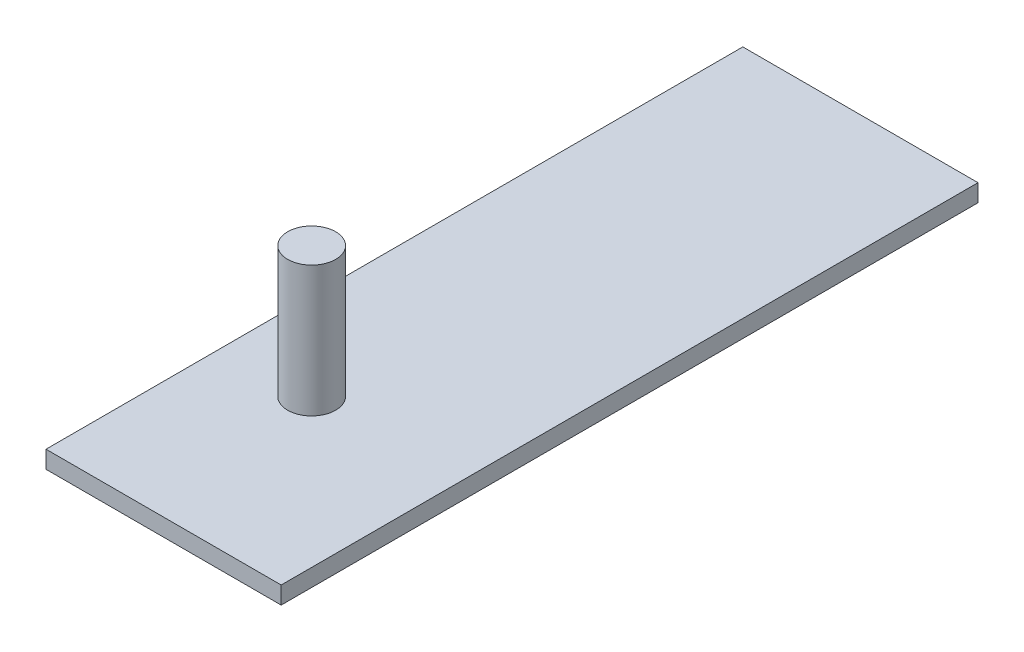
from build123d import *

# Parameters (mm, degrees)
SKETCH1_W           = 27
SKETCH1_H           = 80
BOSS_EXTRUDE1_DEPTH = 2
SKETCH2_R           = 2.753572969
BOSS_EXTRUDE2_DEPTH = 15


with BuildPart() as part:
    # Sketch1 → Boss-Extrude1 (new body)
    with BuildSketch(Plane(origin=(0, 0, 0), x_dir=(1, 0, 0), z_dir=(0, 1, 0))):
        Rectangle(SKETCH1_W, SKETCH1_H)
    extrude(amount=BOSS_EXTRUDE1_DEPTH)

    # Sketch2 → Boss-Extrude2 (add)
    with BuildSketch(Plane(origin=(0, 2, 0), x_dir=(1, 0, 0), z_dir=(0, 1, 0))):
        with Locations(Location((-3.5, -19.5, 0), (0, 0, 270))):
            Circle(SKETCH2_R)
    extrude(amount=BOSS_EXTRUDE2_DEPTH)


solid = part.part
